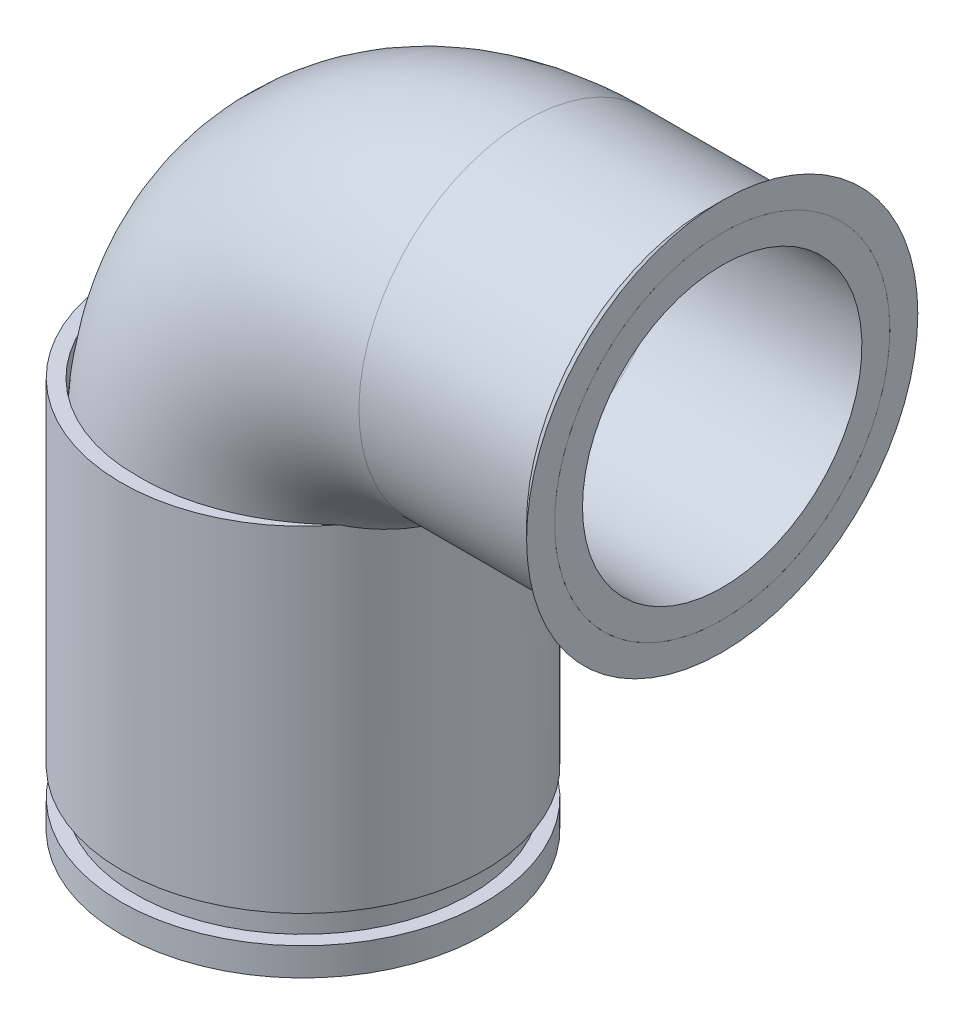
from build123d import *

# Parameters (mm, degrees)
SWEEP_THIN1_PROFILE_R   = 6
SWEEP_THIN1_PROFILE_R_2 = 5
BOSS_EXTRUDE1_START     = -14
SKETCH20_R              = 6.5
SKETCH20_R_2            = 6
BOSS_EXTRUDE1_DEPTH     = 14
CUT_EXTRUDE1_START      = -2
SKETCH20_3_R            = 6.5
SKETCH20_3_R_2          = 6
CUT_EXTRUDE1_DEPTH      = 1
SKETCH22_R              = 7
SKETCH22_R_2            = 6
BOSS_EXTRUDE2_DEPTH     = 2
BOSS_EXTRUDE2_TAPER     = 45


with BuildPart() as part:
    # Sweep-Thin1: sweep along a path in Sketch1
    with BuildLine(Plane.XY) as sweep_thin1_path:
        Line((0, -20), (0, -8))
        ThreePointArc((0, -8), (2.343145751, -2.343145751), (8, 0))
        Line((8, 0), (15, 0))
    # Sweep-Thin1 profile (on start of the path) → Sweep-Thin1 (sweep)
    with BuildSketch(Plane.ZX.offset(-20)):
        Circle(SWEEP_THIN1_PROFILE_R)
        Circle(SWEEP_THIN1_PROFILE_R_2, mode=Mode.SUBTRACT)
    sweep(path=sweep_thin1_path.line)

    # Sketch20 → Boss-Extrude1 (add)
    with BuildSketch(Plane.XZ.offset(20).offset(BOSS_EXTRUDE1_START)):
        with Locations(Location((0, 0, 0), (0, 0, 270))):
            Circle(SKETCH20_R)
        Circle(SKETCH20_R_2, mode=Mode.SUBTRACT)
    extrude(amount=BOSS_EXTRUDE1_DEPTH)

    # Sketch20<3> → Cut-Extrude1 (cut)
    with BuildSketch(Plane.XZ.offset(20).offset(CUT_EXTRUDE1_START)):
        with Locations(Location((0, 0, 0), (0, 0, 270))):
            Circle(SKETCH20_3_R)
        with Locations(Location((0, 0, 0), (0, 0, 270))):
            Circle(SKETCH20_3_R_2, mode=Mode.SUBTRACT)
    extrude(amount=CUT_EXTRUDE1_DEPTH, mode=Mode.SUBTRACT)


with BuildPart() as body_2:
    # Sketch22 → Boss-Extrude2 (new body)
    with BuildSketch(Plane(origin=(15, 0, 0), x_dir=(0, 0, -1), z_dir=(1, 0, 0))):
        Circle(SKETCH22_R)
        with Locations(Location((0, 0, 0), (0, 0, 1.193748438))):
            Circle(SKETCH22_R_2, mode=Mode.SUBTRACT)
    extrude(amount=-BOSS_EXTRUDE2_DEPTH, taper=BOSS_EXTRUDE2_TAPER)


solid = Compound([part.part, body_2.part])
